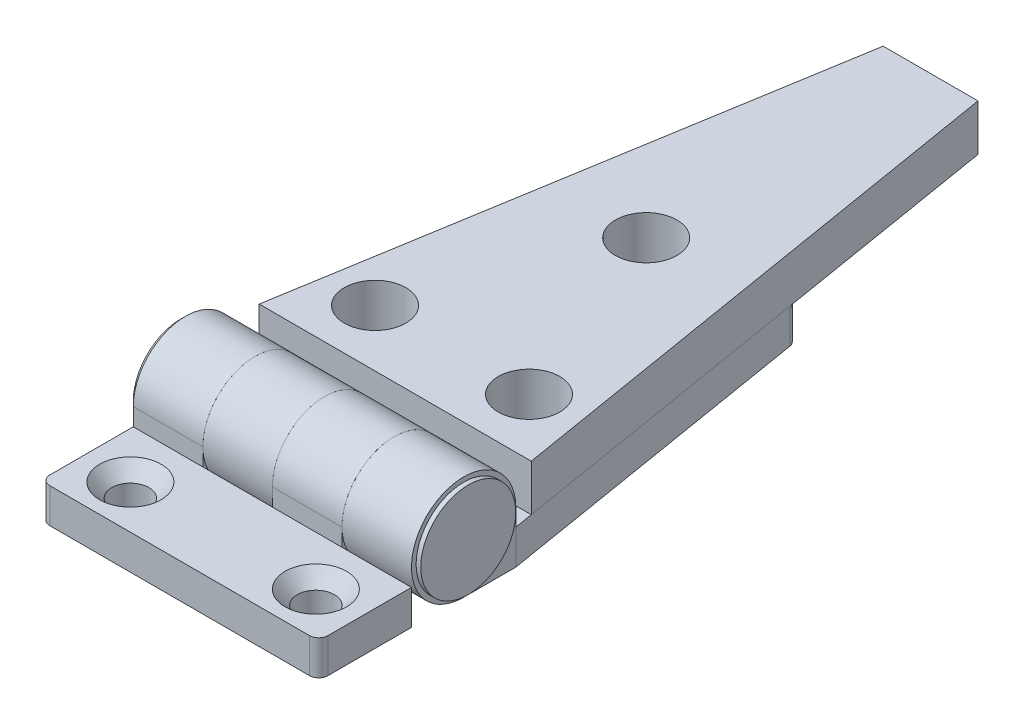
from build123d import *

# Parameters (mm, degrees)
SKETCH1_R                                     = 2.38125
LEFT_LEAF_DEPTH                               = 19.05
CUT_EXTRUDE1_DEPTH                            = 29.420240642
CUT_EXTRUDE1_DEPTH_BACK                       = 29.420240642
SKETCH2_W                                     = 9.525
SKETCH2_H                                     = 14.2875
SKETCH3_R                                     = 2.38125
RIGHT_LEAF_DEPTH                              = 19.05
CUT_EXTRUDE2_DEPTH                            = 57.940152929
CUT_EXTRUDE2_DEPTH_BACK                       = 57.940152929
SKETCH9_W                                     = 9.525
SKETCH9_H                                     = 14.2875
SKETCH10_R                                    = 2.38125
EXTRUDE1_DEPTH                                = 19.05
CUT_EXTRUDE3_DEPTH                            = 58.289751028
FILLET1_R                                     = 1.27
FILLET2_R                                     = 1.27
CSK_FOR_8_FLAT_HEAD_MACHINE_SCREW1_AT_2_COUNT = 2
CSK_FOR_8_FLAT_HEAD_MACHINE_SCREW1_AT_2_PITCH = 28.603741344
CSK_FOR_8_FLAT_HEAD_MACHINE_SCREW1_AT_3_COUNT = 2
CSK_FOR_8_FLAT_HEAD_MACHINE_SCREW1_AT_3_PITCH = 28.603741344
CSK_FOR_8_FLAT_HEAD_MACHINE_SCREW1_AT_4_COUNT = 2
CSK_FOR_8_FLAT_HEAD_MACHINE_SCREW1_AT_4_PITCH = 59.319205693
CSK_FOR_8_FLAT_HEAD_MACHINE_SCREW1_AT_5_COUNT = 2
CSK_FOR_8_FLAT_HEAD_MACHINE_SCREW1_AT_5_PITCH = 59.319205693
SKETCH14_W                                    = 0.635
SKETCH14_H                                    = 6.50875
SKETCH15_R                                    = 4.2164
BOSS_EXTRUDE5_DEPTH                           = 6.35


with BuildPart() as part:
    # Sketch1 → Left Leaf (new, symmetric)
    with BuildSketch(Plane(origin=(0, 0, 0), x_dir=(0, 0, -1), z_dir=(1, 0, 0))):
        with BuildLine():
            Line((-7.14375, 0), (-7.14375, -2.39395))
            Line((-7.14375, -2.39395), (-19.84375, -2.39395))
            Line((-19.84375, -2.39395), (-19.84375, -7.14375))
            Line((-19.84375, -7.14375), (0, -7.14375))
            ThreePointArc((0, -7.14375), (5.051394068, 5.051394068), (-7.14375, 0))
        make_face()
        with Locations(Location((0, 0, 0), (0, 0, 180))):
            Circle(SKETCH1_R, mode=Mode.SUBTRACT)
    extrude(amount=LEFT_LEAF_DEPTH, both=True)

    # Sketch2 → Cut-Extrude1 (cut, two sides: drawn at the far end of the back side and taken through both)
    with BuildSketch(Plane(origin=(0, 0, 0), x_dir=(1, 0, 0), z_dir=(0, 1, 0)).offset(-CUT_EXTRUDE1_DEPTH_BACK)):
        with Locations((14.2875, 0)):
            Rectangle(SKETCH2_W, SKETCH2_H)
        with Locations((-4.7625, 0)):
            Rectangle(SKETCH2_W, SKETCH2_H)
    extrude(amount=CUT_EXTRUDE1_DEPTH + CUT_EXTRUDE1_DEPTH_BACK, mode=Mode.SUBTRACT)

    # Fillet1
    fillet1_edges = [part.edges().sort_by_distance(p)[0] for p in [
        (19.05, -4.76885, 19.84375),
        (-19.05, -4.76885, 19.84375),
    ]]
    fillet(fillet1_edges, radius=FILLET1_R)


with BuildPart() as body_2:
    # Sketch3 → Right Leaf (new, symmetric)
    with BuildSketch(Plane(origin=(0, 0, 0), x_dir=(0, 0, -1), z_dir=(1, 0, 0))):
        with BuildLine():
            Line((53.18125, -2.39395), (53.18125, -7.14375))
            Line((53.18125, -7.14375), (0, -7.14375))
            ThreePointArc((0, -7.14375), (-5.051394068, 5.051394068), (7.14375, 0))
            Line((7.14375, 0), (7.14375, -2.39395))
            Line((7.14375, -2.39395), (53.18125, -2.39395))
        make_face()
        with Locations(Location((0, 0, 0), (0, 0, 180))):
            Circle(SKETCH3_R, mode=Mode.SUBTRACT)
    extrude(amount=RIGHT_LEAF_DEPTH, both=True)

    # Sketch9 → Cut-Extrude2 (cut, two sides: drawn at the far end of the back side and taken through both)
    with BuildSketch(Plane(origin=(0, 0, 0), x_dir=(1, 0, 0), z_dir=(0, 1, 0)).offset(-CUT_EXTRUDE2_DEPTH_BACK)):
        with Locations((4.7625, 0)):
            Rectangle(SKETCH9_W, SKETCH9_H)
        with Locations((-14.2875, 0)):
            Rectangle(SKETCH9_W, SKETCH9_H)
    extrude(amount=CUT_EXTRUDE2_DEPTH + CUT_EXTRUDE2_DEPTH_BACK, mode=Mode.SUBTRACT)

    # Sketch13 → Cut-Extrude3 (cut, through all)
    with BuildSketch(Plane(origin=(0, -2.39395, 0), x_dir=(-1, 0, 0), z_dir=(0, 1, 0))):
        Polygon((19.05, -7.14375), (11.43, -53.18125), (-11.43, -53.18125), (-19.05, -7.14375), (-19.05, -66.077067612), (19.05, -66.077067612), align=None)
    extrude(amount=-CUT_EXTRUDE3_DEPTH, mode=Mode.SUBTRACT)

    # Fillet2
    fillet2_edges = [body_2.edges().sort_by_distance(p)[0] for p in [
        (11.43, -4.76885, -53.18125),
        (-11.43, -4.76885, -53.18125),
    ]]
    fillet(fillet2_edges, radius=FILLET2_R)

    # Sketch12 → CSK for #8 Flat Head Machine Screw1 (revolve, cut)
    with BuildSketch(Plane(origin=(0, -2.39395, -44.053125), x_dir=(0, 0, 1), z_dir=(1, 0, 0))):
        Polygon((0, 0), (0, 4.7498), (2.54, 4.7498), (2.54, 1.928477598), (4.2164, 0), align=None)
    csk_for_8_flat_head_machine_screw1 = revolve(axis=Axis((0, 3.95605, -44.053125), (0, -1, 0)), mode=Mode.SUBTRACT)

    # CSK for #8 Flat Head Machine Screw1 at 2: CSK for #8 Flat Head Machine Screw1 ×2
    with Locations(*[Vector(-0.3685182254001519, 0, 0.9296205234115278) * (i * CSK_FOR_8_FLAT_HEAD_MACHINE_SCREW1_AT_2_PITCH) for i in range(1, CSK_FOR_8_FLAT_HEAD_MACHINE_SCREW1_AT_2_COUNT)]):
        add(csk_for_8_flat_head_machine_screw1, mode=Mode.SUBTRACT)

    # CSK for #8 Flat Head Machine Screw1 at 3: CSK for #8 Flat Head Machine Screw1 ×2
    with Locations(*[Vector(0.3685182254001519, 0, 0.9296205234115278) * (i * CSK_FOR_8_FLAT_HEAD_MACHINE_SCREW1_AT_3_PITCH) for i in range(1, CSK_FOR_8_FLAT_HEAD_MACHINE_SCREW1_AT_3_COUNT)]):
        add(csk_for_8_flat_head_machine_screw1, mode=Mode.SUBTRACT)


with BuildPart() as body_3:
    # Sketch10 → Extrude1 (new, symmetric)
    with BuildSketch(Plane(origin=(0, 0, 0), x_dir=(0, 0, -1), z_dir=(1, 0, 0))):
        with Locations(Location((0, 0, 0), (0, 0, 180))):
            Circle(SKETCH10_R)
    extrude(amount=EXTRUDE1_DEPTH, both=True)

    # Sketch14 → Revolve1 (revolve)
    with BuildSketch(Plane(origin=(0, 0, 0), x_dir=(-1, 0, 0), z_dir=(0, 1, 0)), mode=Mode.PRIVATE) as revolve1_sk:
        with Locations((-19.3675, -3.254375)):
            Rectangle(SKETCH14_W, SKETCH14_H)
        with Locations((19.3675, -3.254375)):
            Rectangle(SKETCH14_W, SKETCH14_H)
    revolve(revolve1_sk.sketch.rotate(Axis((-19.05, 0, 0), (1, 0, 0)), 180), axis=Axis((-19.05, 0, 0), (1, 0, 0)))


with BuildPart() as part_1:
    add(part.part)

    # CSK for #8 Flat Head Machine Screw1 at 4: CSK for #8 Flat Head Machine Screw1 ×2
    with Locations(*[Vector(-0.21409592140700737, 0, 0.9768126414194713) * (i * CSK_FOR_8_FLAT_HEAD_MACHINE_SCREW1_AT_4_PITCH) for i in range(1, CSK_FOR_8_FLAT_HEAD_MACHINE_SCREW1_AT_4_COUNT)]):
        add(csk_for_8_flat_head_machine_screw1, mode=Mode.SUBTRACT)

    # CSK for #8 Flat Head Machine Screw1 at 5: CSK for #8 Flat Head Machine Screw1 ×2
    with Locations(*[Vector(0.21409592140700737, 0, 0.9768126414194713) * (i * CSK_FOR_8_FLAT_HEAD_MACHINE_SCREW1_AT_5_PITCH) for i in range(1, CSK_FOR_8_FLAT_HEAD_MACHINE_SCREW1_AT_5_COUNT)]):
        add(csk_for_8_flat_head_machine_screw1, mode=Mode.SUBTRACT)


with BuildPart() as body_4:
    # Sketch15 → Boss-Extrude5 (new body)
    # profile 1 of 3: a face of its own
    with BuildSketch(Plane(origin=(0, -2.39395, 0), x_dir=(1, 0, 0), z_dir=(0, 1, 0))):
        with BuildLine():
            Line((-18.629586207, 9.68375), (18.629586207, 9.68375))
            Line((18.629586207, 9.68375), (11.605881049, 52.118635331))
            ThreePointArc((11.605881049, 52.118635331), (11.174365963, 52.879826112), (10.352928007, 53.18125))
            Line((10.352928007, 53.18125), (-10.352928007, 53.18125))
            ThreePointArc((-10.352928007, 53.18125), (-11.174365963, 52.879826112), (-11.605881049, 52.118635331))
            Line((-11.605881049, 52.118635331), (-18.629586207, 9.68375))
        make_face()
        with Locations(Location((-10.541, 17.4625, 0), (0, 0, 270))):
            Circle(SKETCH15_R, mode=Mode.SUBTRACT)
        with Locations(Location((0, 44.053125, 0), (0, 0, 270))):
            Circle(SKETCH15_R, mode=Mode.SUBTRACT)
        with Locations(Location((10.541, 17.4625, 0), (0, 0, 270))):
            Circle(SKETCH15_R, mode=Mode.SUBTRACT)
    # profile 2 of 3: a face of its own
    with BuildSketch(Plane(origin=(0, -2.39395, 0), x_dir=(1, 0, 0), z_dir=(0, 1, 0))):
        with BuildLine():
            ThreePointArc((10.352928007, 53.18125), (11.174365963, 52.879826112), (11.605881049, 52.118635331))
            Line((11.605881049, 52.118635331), (10.641724138, 57.94375))
            Line((10.641724138, 57.94375), (-10.641724138, 57.94375))
            Line((-10.641724138, 57.94375), (-11.605881049, 52.118635331))
            ThreePointArc((-11.605881049, 52.118635331), (-11.174365963, 52.879826112), (-10.352928007, 53.18125))
            Line((-10.352928007, 53.18125), (10.352928007, 53.18125))
        make_face()
    # profile 3 of 3: a face of its own
    with BuildSketch(Plane(origin=(0, -2.39395, 0), x_dir=(1, 0, 0), z_dir=(0, 1, 0))):
        Polygon((-6.494017517, 83.002810832), (6.494017517, 83.002810832), (10.641724138, 57.94375), (-10.641724138, 57.94375), align=None)
    extrude(amount=BOSS_EXTRUDE5_DEPTH)


solid = Compound([body_2.part, body_3.part, part_1.part, body_4.part])
